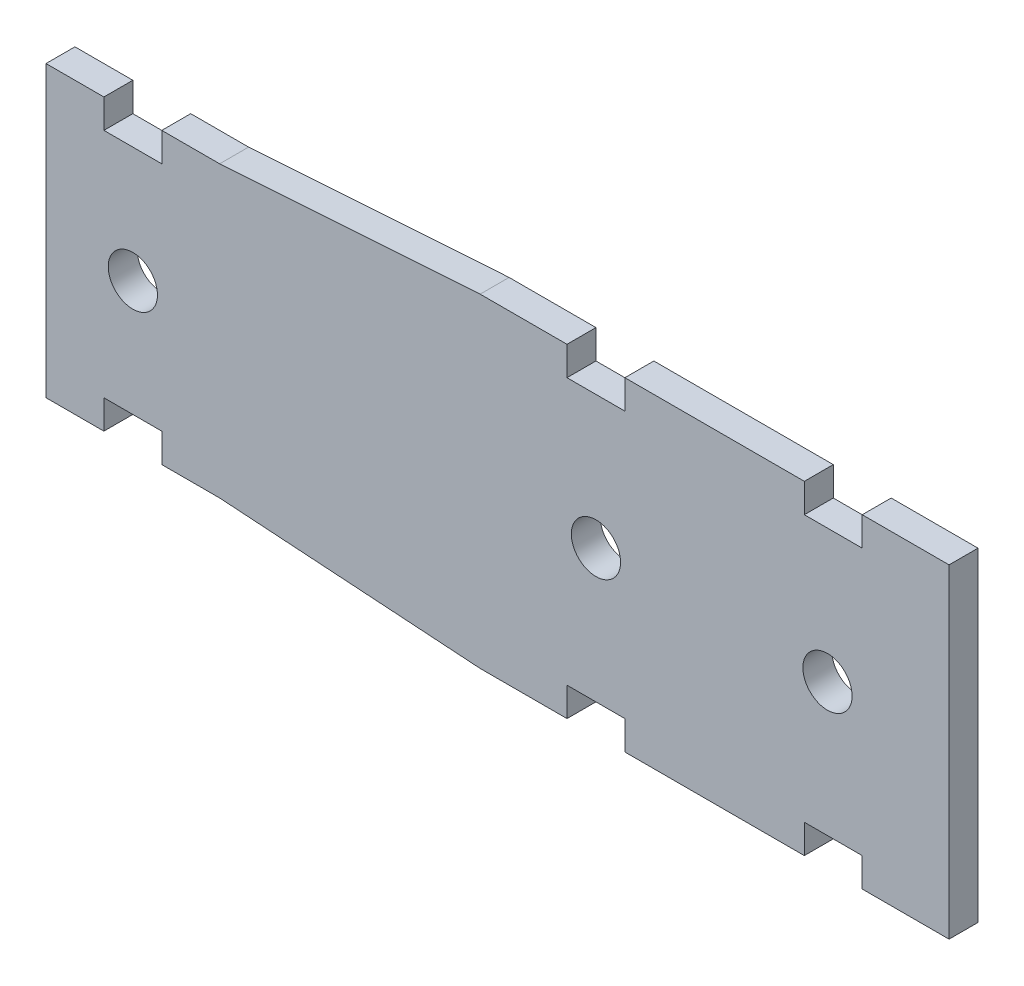
from build123d import *

# Parameters (mm, degrees)
BOSS_EXTRUDE1_DEPTH = 2.5
CUT_EXTRUDE1_REACH  = 111.75
SKETCH2_R           = 4.25


with BuildPart() as part:
    # Sketch1 → Boss-Extrude1 (new, symmetric)
    with BuildSketch(Plane(origin=(0, 0, 0), x_dir=(0, 1, 0), z_dir=(0, 0, 1))):
        Polygon((25, 50), (-25, 50), (-25, 40), (-20, 40), (-20, 30), (-25, 30), (-25, 20), (-28, -25), (-28, -40), (-23, -40), (-23, -50), (-28, -50), (-28, -81), (-23, -81), (-23, -91), (-28, -91), (-28, -106), (28, -106), (28, -91), (23, -91), (23, -81), (28, -81), (28, -50), (23, -50), (23, -40), (28, -40), (28, -25), (25, 20), (25, 30), (20, 30), (20, 40), (25, 40), align=None)
    extrude(amount=BOSS_EXTRUDE1_DEPTH, both=True)

    # Sketch2 → Cut-Extrude1 (cut, up to next)
    with BuildSketch(Plane.XY.offset(2.5), mode=Mode.PRIVATE) as cut_extrude1_sk1:
        with Locations((-35, 0)):
            Circle(SKETCH2_R)
    cut_extrude1_tool1 = extrude(cut_extrude1_sk1.sketch, amount=-CUT_EXTRUDE1_REACH, mode=Mode.PRIVATE) & part.part
    # Sketch2 → Cut-Extrude1 (cut, up to next)
    with BuildSketch(Plane.XY.offset(2.5), mode=Mode.PRIVATE) as cut_extrude1_sk2:
        with Locations((45, 0)):
            Circle(SKETCH2_R)
    cut_extrude1_tool2 = extrude(cut_extrude1_sk2.sketch, amount=-CUT_EXTRUDE1_REACH, mode=Mode.PRIVATE) & part.part
    # Sketch2 → Cut-Extrude1 (cut, up to next)
    with BuildSketch(Plane.XY.offset(2.5), mode=Mode.PRIVATE) as cut_extrude1_sk3:
        with Locations((85, 0)):
            Circle(SKETCH2_R)
    cut_extrude1_tool3 = extrude(cut_extrude1_sk3.sketch, amount=-CUT_EXTRUDE1_REACH, mode=Mode.PRIVATE) & part.part
    add(cut_extrude1_tool1.solids().sort_by_distance((-35, 0, 2.5))[0], mode=Mode.SUBTRACT)
    add(cut_extrude1_tool2.solids().sort_by_distance((45, 0, 2.5))[0], mode=Mode.SUBTRACT)
    add(cut_extrude1_tool3.solids().sort_by_distance((85, 0, 2.5))[0], mode=Mode.SUBTRACT)


solid = part.part
